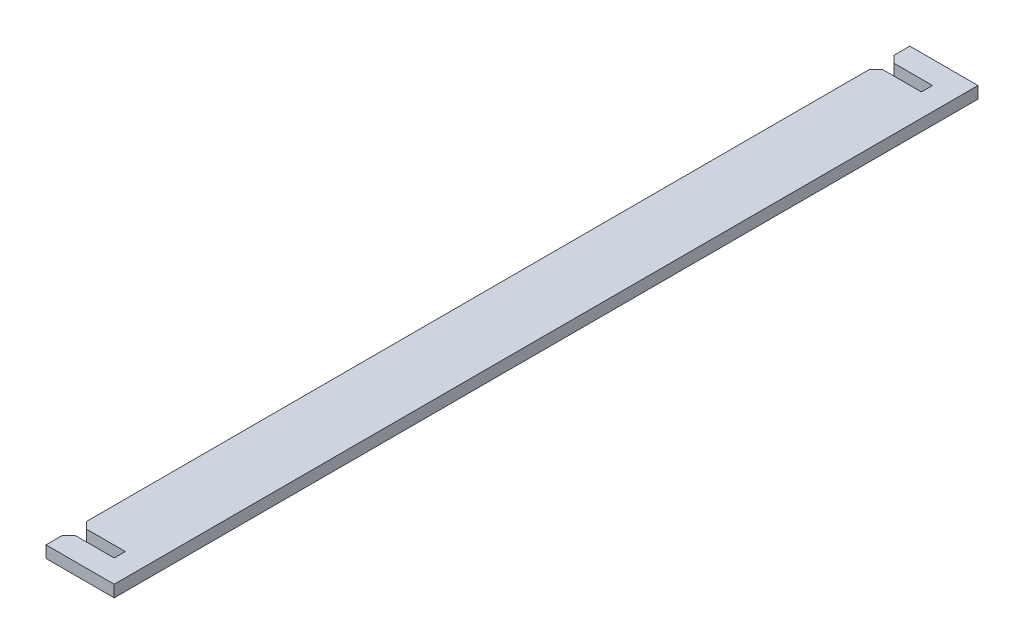
from build123d import *

# Parameters (mm, degrees)
SKETCH1_W           = 30
SKETCH1_H           = 380
BOSS_EXTRUDE1_DEPTH = 5.2
SKETCH2_W           = 20
SKETCH2_H           = 4.9
CUT_EXTRUDE1_DEPTH  = 10
CHAMFER1_SIZE       = 3


with BuildPart() as part:
    # Sketch1 → Boss-Extrude1 (new body)
    with BuildSketch(Plane(origin=(0, 0, 0), x_dir=(1, 0, 0), z_dir=(0, 1, 0))):
        with Locations((15, 190)):
            Rectangle(SKETCH1_W, SKETCH1_H)
    extrude(amount=BOSS_EXTRUDE1_DEPTH)

    # Sketch2 → Cut-Extrude1 (cut)
    with BuildSketch(Plane(origin=(0, 5.2, 0), x_dir=(1, 0, 0), z_dir=(0, 1, 0))):
        with Locations((10, 367.55)):
            Rectangle(SKETCH2_W, SKETCH2_H)
        with Locations((10, 12.45)):
            Rectangle(SKETCH2_W, SKETCH2_H)
    extrude(amount=-CUT_EXTRUDE1_DEPTH, mode=Mode.SUBTRACT)

    # Chamfer1
    chamfer1_edges = [part.edges().sort_by_distance(p)[0] for p in [
        (0, 2.6, -365.1),
        (0, 2.6, -370),
        (0, 2.6, -10),
        (0, 2.6, -14.9),
    ]]
    chamfer(chamfer1_edges, length=CHAMFER1_SIZE)


solid = part.part
